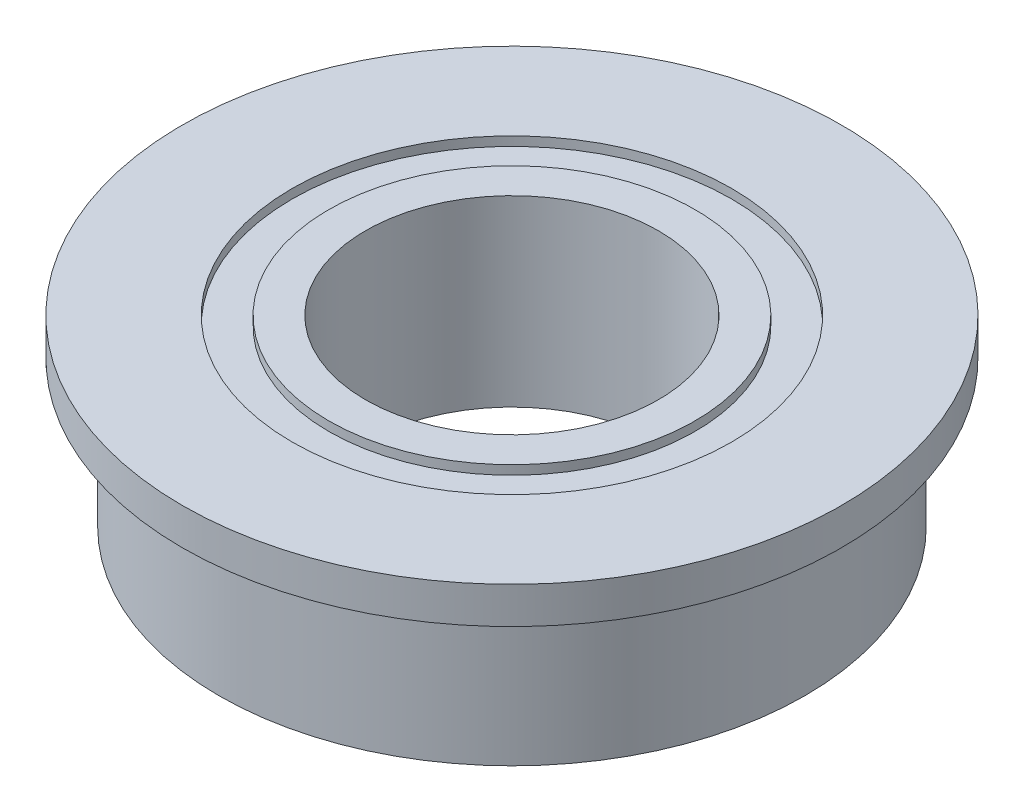
from build123d import *


with BuildPart() as part:
    # Sketch1 → Revolve1 (revolve)
    with BuildSketch(Plane(origin=(0, 0, 0), x_dir=(0, -1, 0), z_dir=(1, 0, 0)), mode=Mode.PRIVATE) as revolve1_sk:
        Polygon((-2.5, 9), (-1.5, 9), (-1.5, 8), (2.5, 8), (2.5, 6), (2.25, 6), (2.25, 5), (2.5, 5), (2.5, 4), (-2.5, 4), (-2.5, 5), (-2.25, 5), (-2.25, 6), (-2.5, 6), align=None)
    revolve(revolve1_sk.sketch.rotate(Axis((0, 0, 0), (0, -1, 0)), 180), axis=Axis((0, 0, 0), (0, -1, 0)))


solid = part.part
